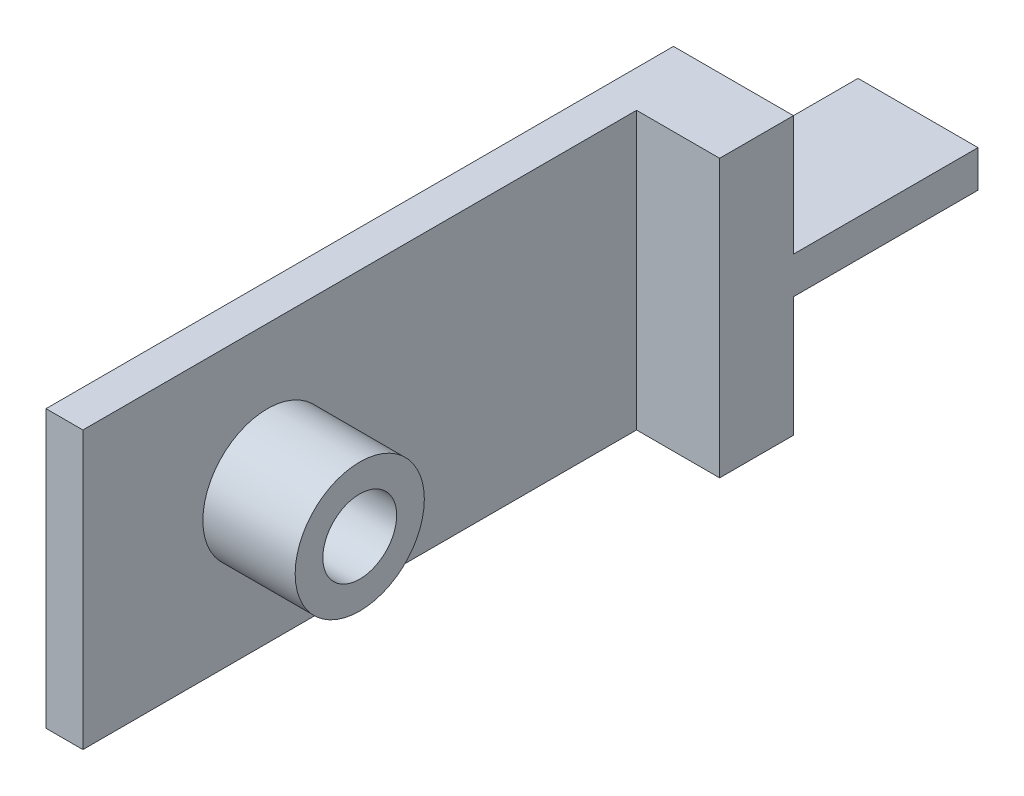
from build123d import *

# Parameters (mm, degrees)
SKETCH1_W           = 30
SKETCH1_H           = 15
BOSS_EXTRUDE1_DEPTH = 2
SKETCH2_W           = 6.5
SKETCH2_H           = 15
BOSS_EXTRUDE2_DEPTH = 4
SKETCH3_W           = 6.5
SKETCH3_H           = 2
BOSS_EXTRUDE3_DEPTH = 10
SKETCH4_R           = 2
CUT_EXTRUDE2_DEPTH  = 5
BOSS_EXTRUDE4_START = 5
SKETCH5_R           = 3.5
SKETCH5_R_2         = 2
BOSS_EXTRUDE4_DEPTH = 5


with BuildPart() as part:
    # Sketch1 → Boss-Extrude1 (new body)
    with BuildSketch(Plane(origin=(0, 0, 0), x_dir=(0, 0, -1), z_dir=(1, 0, 0))):
        with Locations((15, 7.5)):
            Rectangle(SKETCH1_W, SKETCH1_H)
    extrude(amount=BOSS_EXTRUDE1_DEPTH)

    # Sketch2 → Boss-Extrude2 (add)
    with BuildSketch(Plane(origin=(0, 0, -30), x_dir=(-1, 0, 0), z_dir=(0, 0, -1))):
        with Locations((-3.25, 7.5)):
            Rectangle(SKETCH2_W, SKETCH2_H)
    extrude(amount=BOSS_EXTRUDE2_DEPTH)

    # Sketch3 → Boss-Extrude3 (add)
    with BuildSketch(Plane(origin=(0, 0, -34), x_dir=(-1, 0, 0), z_dir=(0, 0, -1))):
        with Locations((-3.25, 7.5)):
            Rectangle(SKETCH3_W, SKETCH3_H)
    extrude(amount=BOSS_EXTRUDE3_DEPTH)

    # Sketch4 → Cut-Extrude2 (cut)
    with BuildSketch(Plane(origin=(2, 0, 0), x_dir=(0, 0, -1), z_dir=(1, 0, 0))):
        with Locations((10, 7.5)):
            Circle(SKETCH4_R)
    extrude(amount=-CUT_EXTRUDE2_DEPTH, mode=Mode.SUBTRACT)

    # Sketch5 → Boss-Extrude4 (add)
    with BuildSketch(Plane(origin=(2, 0, 0), x_dir=(0, 0, -1), z_dir=(1, 0, 0)).offset(BOSS_EXTRUDE4_START)):
        with Locations(Location((10, 7.5, 0), (0, 0, 180))):
            Circle(SKETCH5_R)
        with Locations((10, 7.5)):
            Circle(SKETCH5_R_2, mode=Mode.SUBTRACT)
    extrude(amount=-BOSS_EXTRUDE4_DEPTH)


solid = part.part
